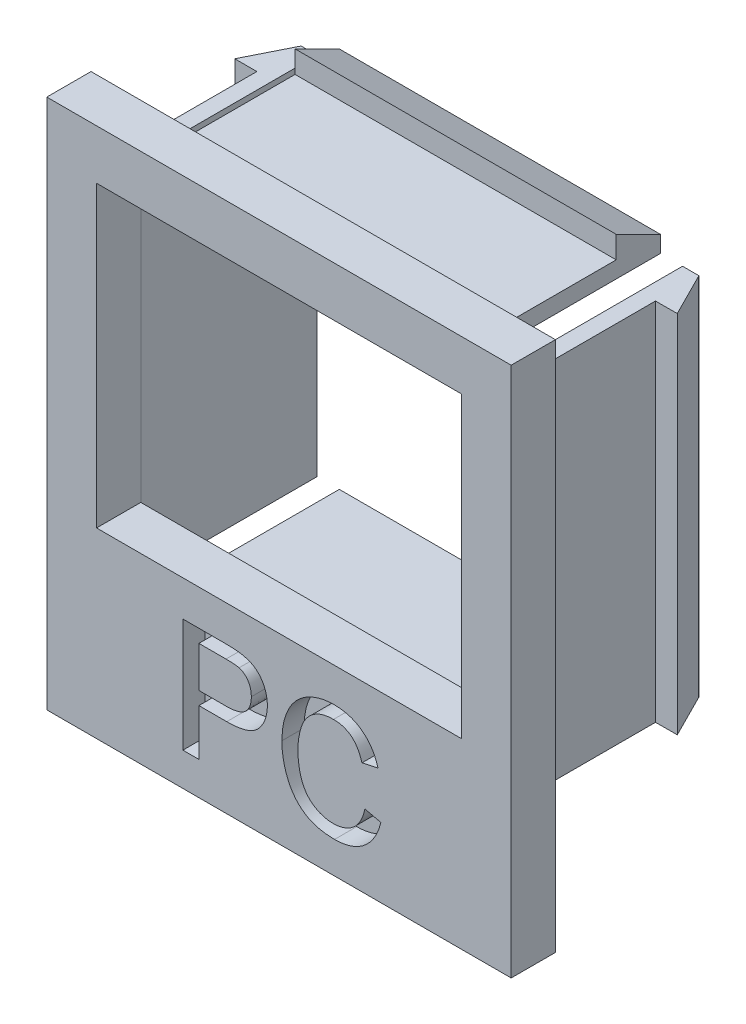
from build123d import *

# Parameters (mm, degrees)
SKETCH_1_W          = 21
SKETCH_1_H          = 21
SKETCH_1_W_2        = 18
SKETCH_1_H_2        = 18
EXTRUDE_1_DEPTH     = 2
SKETCH_2_W          = 18
SKETCH_2_H          = 18
SKETCH_2_W_2        = 16.5
SKETCH_2_H_2        = 16.5
EXTRUDE_2_DEPTH     = 10
SKETCH_4_W          = 16.5
SKETCH_4_H          = 3
EXTRUDE_3_DEPTH     = 2
SKETCH_5_W          = 21
SKETCH_5_H          = 3
EXTRUDE_4_DEPTH     = 2
CUT_EXTRUDE_1_DEPTH = 1
SKETCH_7_W          = 1
SKETCH_7_H          = 18
CUT_EXTRUDE_2_DEPTH = 8
SKETCH_8_W          = 0.75
SKETCH_8_H          = 0.75
SKETCH_8_W_2        = 0.727179426
CUT_EXTRUDE_3_DEPTH = 8
EXTRUDE_5_DEPTH     = 16.5
EXTRUDE_6_DEPTH     = 14.522820574


with BuildPart() as part:
    # Эскиз1 → Бобышка-Вытянуть1 (new body)
    with BuildSketch(Plane.XY):
        Rectangle(SKETCH_1_W, SKETCH_1_H)
        Rectangle(SKETCH_1_W_2, SKETCH_1_H_2, mode=Mode.SUBTRACT)
    extrude(amount=EXTRUDE_1_DEPTH)

    # Эскиз2 → Бобышка-Вытянуть2 (add)
    with BuildSketch(Plane.XY.offset(2)):
        Rectangle(SKETCH_2_W, SKETCH_2_H)
        Rectangle(SKETCH_2_W_2, SKETCH_2_H_2, mode=Mode.SUBTRACT)
    extrude(amount=-EXTRUDE_2_DEPTH)

    # Эскиз4 → Бобышка-Вытянуть3 (add)
    with BuildSketch(Plane.XY.offset(2)):
        with Locations((0, -6.75)):
            Rectangle(SKETCH_4_W, SKETCH_4_H)
    extrude(amount=-EXTRUDE_3_DEPTH)

    # Эскиз5 → Бобышка-Вытянуть4 (add)
    with BuildSketch(Plane.XY.offset(2)):
        with Locations((0, -12)):
            Rectangle(SKETCH_5_W, SKETCH_5_H)
    extrude(amount=-EXTRUDE_4_DEPTH)

    # Эскиз6 → Вырез-Вытянуть1 (cut)
    # profile 1 of 2: a face of its own
    with BuildSketch(Plane.XY.offset(2)):
        with BuildLine():
            Line((-4.346385467, -12), (-4.346385467, -6.86336263))
            Line((-4.346385467, -6.86336263), (-2.459247459, -6.86336263))
            add(Edge.make_bspline(
                [(-2.459247459, -6.86336263), (-2.381027109, -6.863808258), (-2.234128926, -6.864645149), (-2.028987501, -6.874446218), (-1.852829228, -6.886571763), (-1.746428923, -6.903835386), (-1.697806823, -6.9117244)],
                knots=[0, 0, 0, 0, 1.22865052, 2.30741144, 3.226532197, 4, 4, 4, 4], degree=3))
            add(Edge.make_bspline(
                [(-1.697806823, -6.9117244), (-1.638499599, -6.923138208), (-1.523545666, -6.945261349), (-1.360788716, -6.998595444), (-1.212507705, -7.064965653), (-1.07893437, -7.147656086), (-0.957849644, -7.244797118), (-0.850979122, -7.361194877), (-0.756246471, -7.494250407), (-0.67569478, -7.6438596), (-0.608647839, -7.804839027), (-0.5616879, -7.976337819), (-0.531609975, -8.155376417), (-0.528444074, -8.277735525), (-0.526834602, -8.339940079)],
                knots=[0, 0, 0, 0, 1.070909925, 2.075721949, 3.031861647, 3.947440733, 4.85625699, 5.777986723, 6.742441087, 7.747548058, 8.78749499, 9.830146138, 10.896896232, 12, 12, 12, 12], degree=3))
            add(Edge.make_bspline(
                [(-0.526834602, -8.339940079), (-0.527968863, -8.393162273), (-0.530200584, -8.497879855), (-0.549364017, -8.651725095), (-0.579588893, -8.799730472), (-0.624673395, -8.94088316), (-0.67979041, -9.076833375), (-0.749250585, -9.205288283), (-0.830360471, -9.327992193), (-0.923418682, -9.444611217), (-1.032974042, -9.55277889), (-1.164782607, -9.644537895), (-1.316303097, -9.721589665), (-1.48757085, -9.783846662), (-1.678170111, -9.832832886), (-1.888725383, -9.868724396), (-2.119646836, -9.888539496), (-2.280168885, -9.891252374), (-2.363552892, -9.892661592)],
                knots=[0, 0, 0, 0, 0.928769099, 1.82740408, 2.702266355, 3.562020322, 4.410419678, 5.259600434, 6.10654066, 6.975254961, 7.860221694, 8.783881459, 9.766664779, 10.81996744, 11.958551584, 13.197863772, 14.544415867, 16, 16, 16, 16], degree=3))
            Line((-2.363552892, -9.892661592), (-3.621987889, -9.892661592))
            Line((-3.621987889, -9.892661592), (-3.621987889, -12))
            Line((-3.621987889, -12), (-4.346385467, -12))
        make_face()
        with BuildLine():
            Line((-3.621987889, -9.299972665), (-2.383103395, -9.299972665))
            add(Edge.make_bspline(
                [(-2.383103395, -9.299972665), (-2.333691813, -9.299146484), (-2.23850498, -9.297554924), (-2.100964347, -9.286448154), (-1.974735985, -9.267222846), (-1.859469748, -9.240409171), (-1.755018863, -9.207080542), (-1.661570217, -9.164929), (-1.579605692, -9.114365831), (-1.508582174, -9.055906276), (-1.447616498, -8.990417313), (-1.39479119, -8.918972469), (-1.349907952, -8.841061189), (-1.314724798, -8.7563575), (-1.284919815, -8.666509054), (-1.266316125, -8.569654184), (-1.253381038, -8.467197428), (-1.251958509, -8.396577427), (-1.25123218, -8.360519556)],
                knots=[0, 0, 0, 0, 1.403696362, 2.704090955, 3.91683431, 5.027708188, 6.063065288, 7.026749679, 7.932587242, 8.790956304, 9.632005367, 10.468072405, 11.310475089, 12.179234342, 13.069796908, 13.994719932, 14.976123913, 16, 16, 16, 16], degree=3))
            add(Edge.make_bspline(
                [(-1.25123218, -8.360519556), (-1.25276665, -8.308229892), (-1.255739916, -8.206910779), (-1.285696316, -8.061115696), (-1.332661624, -7.926398454), (-1.399902122, -7.805309675), (-1.481282684, -7.699082564), (-1.57694381, -7.612171302), (-1.683818578, -7.542688952), (-1.763616362, -7.515177329), (-1.803791128, -7.501326406)],
                knots=[0, 0, 0, 0, 1.143156811, 2.215038775, 3.243253804, 4.254666983, 5.233799895, 6.158487526, 7.072877374, 8, 8, 8, 8], degree=3))
            add(Edge.make_bspline(
                [(-1.803791128, -7.501326406), (-1.818504414, -7.497728682), (-1.850477397, -7.489910582), (-1.903440394, -7.481036919), (-1.964821716, -7.472634349), (-2.034920568, -7.467059635), (-2.113097665, -7.461523235), (-2.199592004, -7.458971092), (-2.294600618, -7.456766768), (-2.360807203, -7.456297245), (-2.395451081, -7.456051557)],
                knots=[0, 0, 0, 0, 0.611063981, 1.327884044, 2.165719042, 3.110592661, 4.16481496, 5.328235826, 6.601947678, 8, 8, 8, 8], degree=3))
            Line((-2.395451081, -7.456051557), (-3.621987889, -7.456051557))
            Line((-3.621987889, -7.456051557), (-3.621987889, -9.299972665))
        make_face(mode=Mode.SUBTRACT)
    # profile 2 of 2: a face of its own
    with BuildSketch(Plane.XY.offset(2)):
        with BuildLine():
            Line((3.88540519, -10.186948108), (4.609802768, -10.355699816))
            add(Edge.make_bspline(
                [(4.609802768, -10.355699816), (4.591654586, -10.423595589), (4.556154491, -10.556408147), (4.48596649, -10.746477619), (4.407189067, -10.924849711), (4.317910725, -11.09105456), (4.217154319, -11.24413659), (4.107589489, -11.386063201), (3.984876526, -11.513858057), (3.853517914, -11.630470598), (3.712490883, -11.733322548), (3.563495737, -11.822137094), (3.407252685, -11.897700243), (3.243130243, -11.959838738), (3.071022008, -12.006603283), (2.891814167, -12.040688023), (2.704984164, -12.061682237), (2.577634427, -12.064446187), (2.512754098, -12.065854325)],
                knots=[0, 0, 0, 0, 1.145254194, 2.240259345, 3.299159039, 4.322497661, 5.312016644, 6.284080175, 7.241264552, 8.196044782, 9.144516039, 10.082428046, 11.020306713, 11.970622414, 12.939253955, 13.924100776, 14.94240044, 16, 16, 16, 16], degree=3))
            add(Edge.make_bspline(
                [(2.512754098, -12.065854325), (2.446185623, -12.064887205), (2.315949722, -12.062995111), (2.125161636, -12.047605323), (1.943703431, -12.02091413), (1.771913977, -11.983830538), (1.609215052, -11.937978981), (1.456281322, -11.88029366), (1.313380657, -11.811190796), (1.179321075, -11.73260298), (1.054671973, -11.643323682), (0.936598788, -11.545762307), (0.827967942, -11.4372331), (0.726063255, -11.320298535), (0.633104248, -11.193416082), (0.545670938, -11.058309494), (0.468030894, -10.912598197), (0.397306838, -10.758983683), (0.335230822, -10.598953217), (0.28031526, -10.435667841), (0.235418787, -10.268802193), (0.19676582, -10.099760418), (0.168686313, -9.927120146), (0.146392054, -9.752176706), (0.134134222, -9.573857544), (0.13252122, -9.453992706), (0.131708651, -9.393609283)],
                knots=[0, 0, 0, 0, 1.180702053, 2.309949215, 3.392367133, 4.431746864, 5.425408375, 6.388154007, 7.326956194, 8.237882283, 9.141054626, 10.043899035, 10.951650021, 11.86168169, 12.792564695, 13.739356664, 14.713891418, 15.718426911, 16.737522708, 17.757217648, 18.772674716, 19.801476837, 20.831699174, 21.873853055, 22.928926693, 24, 24, 24, 24], degree=3))
            add(Edge.make_bspline(
                [(0.131708651, -9.393609283), (0.132870796, -9.328422944), (0.135166903, -9.199631201), (0.148128389, -9.009595247), (0.171933941, -8.826187303), (0.204992927, -8.649286727), (0.246825771, -8.478750256), (0.298463727, -8.314494805), (0.359253578, -8.156730537), (0.429009996, -8.005283486), (0.50819643, -7.861844199), (0.594449489, -7.726208766), (0.68982664, -7.600604261), (0.791500092, -7.482630975), (0.902009207, -7.374253296), (1.021016541, -7.275225723), (1.147495347, -7.184644998), (1.281427165, -7.103352037), (1.42106135, -7.032021717), (1.564323884, -6.96848718), (1.711784585, -6.91641199), (1.862274341, -6.873113563), (2.016117145, -6.838643993), (2.173672465, -6.815594084), (2.334794718, -6.800572978), (2.443435925, -6.798537257), (2.498348464, -6.797508305)],
                knots=[0, 0, 0, 0, 1.185634383, 2.342514083, 3.462112933, 4.547331452, 5.613960142, 6.653690668, 7.676612054, 8.686959706, 9.683658101, 10.654407272, 11.607580201, 12.5494388, 13.484601218, 14.419076806, 15.362504069, 16.311442244, 17.265594461, 18.212500624, 19.159571152, 20.107257795, 21.059246075, 22.024387127, 23.001429356, 24, 24, 24, 24], degree=3))
            add(Edge.make_bspline(
                [(2.498348464, -6.797508305), (2.559788198, -6.798666414), (2.680554079, -6.800942791), (2.857756493, -6.819666441), (3.027470138, -6.851026505), (3.190430416, -6.892167943), (3.344943058, -6.948499136), (3.492685565, -7.01547045), (3.632188193, -7.095928372), (3.764536391, -7.187661772), (3.887575733, -7.290839827), (4.003028025, -7.402997643), (4.106185728, -7.526938347), (4.201134514, -7.659662353), (4.284886978, -7.803010089), (4.360524289, -7.955731718), (4.425570175, -8.11896255), (4.460372963, -8.23265734), (4.478094117, -8.290549335)],
                knots=[0, 0, 0, 0, 1.098391872, 2.158997981, 3.181470371, 4.182549255, 5.160268219, 6.118029851, 7.079534476, 8.035645336, 8.993622929, 9.94770573, 10.909620999, 11.872786677, 12.862530088, 13.874594564, 14.917769567, 16, 16, 16, 16], degree=3))
            Line((4.478094117, -8.290549335), (3.753696539, -8.445924384))
            add(Edge.make_bspline(
                [(3.753696539, -8.445924384), (3.739470502, -8.40149525), (3.711625744, -8.314533688), (3.662184653, -8.190598007), (3.608789924, -8.075545203), (3.550169649, -7.970157353), (3.486196787, -7.874409215), (3.418344462, -7.78713711), (3.344987001, -7.709969987), (3.267616556, -7.641128564), (3.184235195, -7.58248226), (3.096797739, -7.530511982), (3.00346057, -7.487514503), (2.905566412, -7.451147518), (2.802200259, -7.423468324), (2.693783032, -7.403994919), (2.580219473, -7.392724666), (2.502832286, -7.39105089), (2.463363354, -7.390197232)],
                knots=[0, 0, 0, 0, 1.235697765, 2.418642872, 3.532555292, 4.594392283, 5.610119701, 6.580908344, 7.519430642, 8.427315627, 9.319973334, 10.216139639, 11.118687699, 12.038725643, 12.980015607, 13.949697744, 14.954307006, 16, 16, 16, 16], degree=3))
            add(Edge.make_bspline(
                [(2.463363354, -7.390197232), (2.41804941, -7.390854693), (2.328930254, -7.392147723), (2.198003493, -7.406299798), (2.072268264, -7.427144423), (1.952661668, -7.45840273), (1.838529209, -7.49737371), (1.730548168, -7.545899476), (1.627800011, -7.602777366), (1.531431459, -7.668348938), (1.442252404, -7.742064005), (1.357842783, -7.819992364), (1.282255195, -7.905768417), (1.212607259, -7.996563786), (1.150927121, -8.093982892), (1.095404664, -8.19669877), (1.046393802, -8.305553255), (0.992968634, -8.458757698), (0.938494514, -8.656081477), (0.891238148, -8.897541827), (0.861136958, -9.142806368), (0.857786684, -9.307775769), (0.856106228, -9.390522362)],
                knots=[0, 0, 0, 0, 0.935256702, 1.839373932, 2.716087708, 3.564631604, 4.388828665, 5.203538865, 6.005592122, 6.810952829, 7.606223804, 8.392839071, 9.180346482, 9.963639178, 10.753404291, 11.558266631, 12.372976832, 13.215232055, 14.905983541, 16.594894834, 18.292041732, 20, 20, 20, 20], degree=3))
            add(Edge.make_bspline(
                [(0.856106228, -9.390522362), (0.858001544, -9.494562355), (0.861678627, -9.696409363), (0.897962402, -9.988919019), (0.953281993, -10.261751794), (1.02004477, -10.474615719), (1.087014542, -10.631628159), (1.141176329, -10.741586234), (1.202999849, -10.843336103), (1.270947324, -10.937455615), (1.34589399, -11.023670226), (1.426795687, -11.102437915), (1.513670488, -11.174516611), (1.607547778, -11.236532181), (1.704814102, -11.291596599), (1.804242037, -11.340560931), (1.905894184, -11.381972796), (2.010180667, -11.414142373), (2.115637025, -11.441941361), (2.22342475, -11.460100964), (2.333513106, -11.470349673), (2.407434715, -11.472219298), (2.444841825, -11.473165398)],
                knots=[0, 0, 0, 0, 2.10686522, 4.087509323, 5.961373225, 7.741398778, 8.594514555, 9.418024779, 10.222433421, 11.003575649, 11.767087398, 12.533660211, 13.289033706, 14.050297079, 14.809623433, 15.552362432, 16.294320901, 17.0305302, 17.761969017, 18.502233515, 19.242073914, 20, 20, 20, 20], degree=3))
            add(Edge.make_bspline(
                [(2.444841825, -11.473165398), (2.489482089, -11.472229198), (2.577662394, -11.470379871), (2.706945919, -11.454192613), (2.831573454, -11.430338569), (2.950035155, -11.393529372), (3.063924465, -11.348460823), (3.172308258, -11.29288342), (3.274845681, -11.226040025), (3.372742801, -11.150145629), (3.464194309, -11.063790775), (3.5480047, -10.967671181), (3.62319209, -10.86134865), (3.69290972, -10.746529505), (3.751485344, -10.619783674), (3.805740201, -10.484888892), (3.850949268, -10.339628042), (3.873754895, -10.238572509), (3.88540519, -10.186948108)],
                knots=[0, 0, 0, 0, 1.013374089, 2.001772144, 2.95501459, 3.891367103, 4.814208647, 5.733921849, 6.652182523, 7.590185968, 8.54346024, 9.504121027, 10.481158517, 11.497760682, 12.549996529, 13.647863555, 14.798406869, 16, 16, 16, 16], degree=3))
        make_face()
    extrude(amount=-CUT_EXTRUDE_1_DEPTH, mode=Mode.SUBTRACT)

    # Эскиз7 → Вырез-Вытянуть2 (cut)
    with BuildSketch(Plane(origin=(0, 0, -8), x_dir=(-1, 0, 0), z_dir=(0, 0, -1))):
        with Locations((-7.75, 0)):
            Rectangle(SKETCH_7_W, SKETCH_7_H)
        with Locations((7.772820574, 0)):
            Rectangle(SKETCH_7_W, SKETCH_7_H)
    extrude(amount=-CUT_EXTRUDE_2_DEPTH, mode=Mode.SUBTRACT)

    # Эскиз8 → Вырез-Вытянуть3 (cut)
    with BuildSketch(Plane(origin=(0, 0, -8), x_dir=(-1, 0, 0), z_dir=(0, 0, -1))):
        with Locations((-8.625, 8.625)):
            Rectangle(SKETCH_8_W, SKETCH_8_H)
        with Locations((8.636410287, 8.625)):
            Rectangle(SKETCH_8_W_2, SKETCH_8_H)
        with Locations((8.636410287, -8.625)):
            Rectangle(SKETCH_8_W_2, SKETCH_8_H)
        with Locations((-8.625, -8.625)):
            Rectangle(SKETCH_8_W, SKETCH_8_H)
    extrude(amount=-CUT_EXTRUDE_3_DEPTH, mode=Mode.SUBTRACT)

    # Эскиз10 → Бобышка-Вытянуть5 (add)
    with BuildSketch(Plane(origin=(0, 8.25, 0), x_dir=(1, 0, 0), z_dir=(0, 1, 0))):
        Polygon((8.977142855, 8.025640545), (9.982843918, 6.028501249), (8.982847987, 6.025648683), align=None)
        Polygon((-9, 6), (-9, 8), (-10, 6), align=None)
    extrude(amount=-EXTRUDE_5_DEPTH)

    # Эскиз12 → Бобышка-Вытянуть6 (add)
    with BuildSketch(Plane.ZY.offset(7.272820574)):
        Polygon((-6, 10), (-8, 9), (-6, 9), align=None)
        Polygon((-6, -9), (-8, -9), (-6, -10), align=None)
    extrude(amount=-EXTRUDE_6_DEPTH)


solid = part.part
